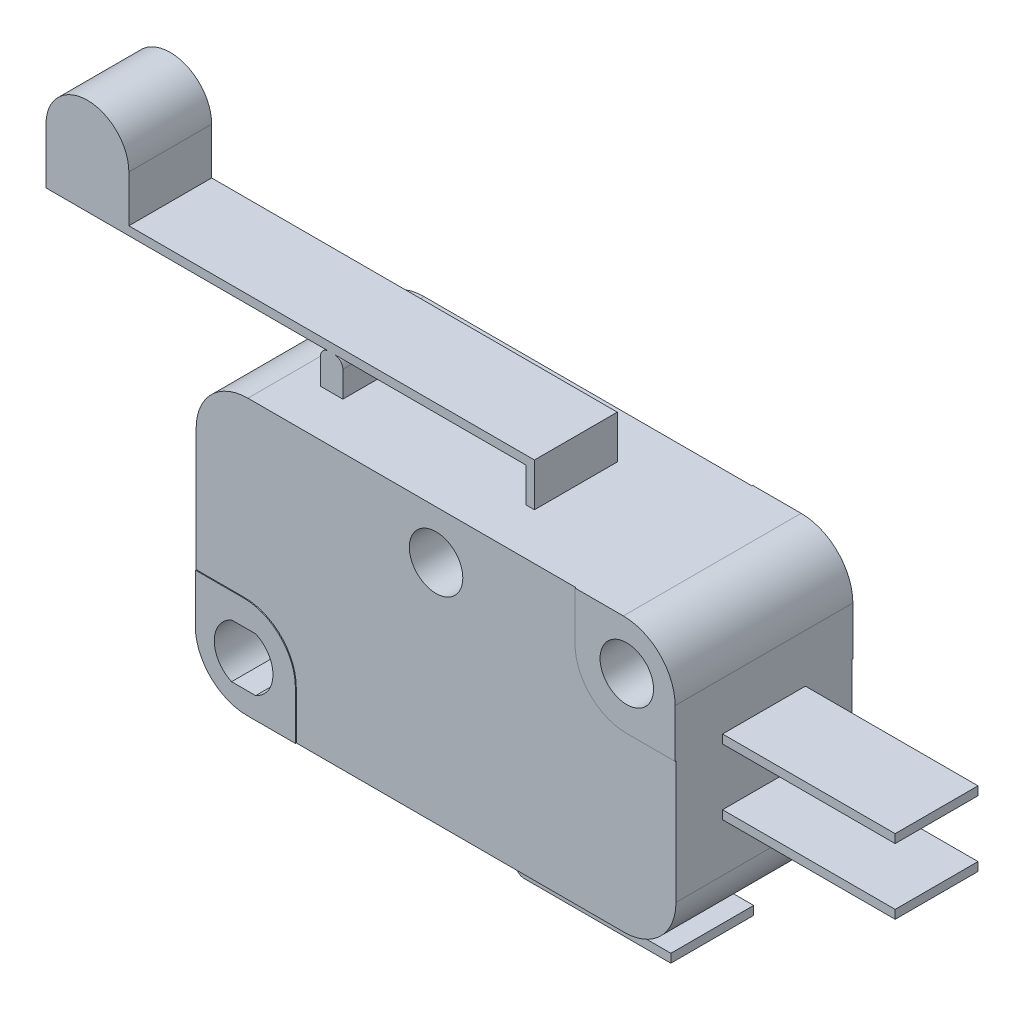
from build123d import *

# Parameters (mm, degrees)
BOSS_EXTRUDE1_DEPTH      = 5.1
BOSS_EXTRUDE1_DEPTH_BACK = 5.1
SKETCH1_R                = 1.55
BOSS_EXTRUDE2_DEPTH      = 5.15
BOSS_EXTRUDE2_DEPTH_BACK = 5.15
SKETCH1_3_R              = 1.55
BOSS_EXTRUDE3_DEPTH      = 2.4
BOSS_EXTRUDE3_DEPTH_BACK = 2.4
SKETCH1_4_W              = 10
SKETCH1_4_H              = 0.5


with BuildPart() as part:
    # Sketch1 → Boss-Extrude1 (new, two sides: drawn at the far end of the back side and taken through both)
    with BuildSketch(Plane.XY.offset(-BOSS_EXTRUDE1_DEPTH_BACK)):
        with BuildLine():
            Line((5.8, 2.8), (5.8, 0))
            Line((5.8, 0), (15.802181202, 0))
            Line((15.802181202, 0), (16.302181202, 0))
            Line((16.302181202, 0), (24.8, 0))
            ThreePointArc((24.8, 0), (26.921320344, 0.878679656), (27.8, 3))
            Line((27.8, 3), (27.8, 5.8))
            Line((27.8, 5.8), (27.8, 6.3))
            Line((27.8, 6.3), (27.8, 9.6))
            Line((27.8, 9.6), (27.8, 10.1))
            Line((27.8, 10.1), (25, 10.1))
            ThreePointArc((25, 10.1), (22.878679656, 10.978679656), (22, 13.1))
            Line((22, 13.1), (22, 15.9))
            Line((22, 15.9), (16.9, 15.9))
            Line((16.9, 15.9), (16.4, 15.9))
            Line((16.4, 15.9), (5.8, 15.9))
            Line((5.8, 15.9), (4.5, 15.9))
            Line((4.5, 15.9), (3, 15.9))
            ThreePointArc((3, 15.9), (0.878679656, 15.021320344), (0, 12.9))
            Line((0, 12.9), (0, 5.8))
            Line((0, 5.8), (2.8, 5.8))
            ThreePointArc((2.8, 5.8), (4.921320344, 4.921320344), (5.8, 2.8))
        make_face()
        with Locations((13.9, 13.1)):
            Circle(SKETCH1_R, mode=Mode.SUBTRACT)
    extrude(amount=BOSS_EXTRUDE1_DEPTH + BOSS_EXTRUDE1_DEPTH_BACK)

    # Sketch1<3> → Boss-Extrude2 (add, two sides: drawn at the far end of the back side and taken through both)
    # profile 1 of 2: a face of its own
    with BuildSketch(Plane.XY.offset(-BOSS_EXTRUDE2_DEPTH_BACK)):
        with BuildLine():
            ThreePointArc((0, 3), (0.878679656, 0.878679656), (3, 0))
            Line((3, 0), (5.8, 0))
            Line((5.8, 0), (5.8, 2.8))
            ThreePointArc((5.8, 2.8), (4.921320344, 4.921320344), (2.8, 5.8))
            Line((2.8, 5.8), (0, 5.8))
            Line((0, 5.8), (0, 3))
        make_face()
        with BuildLine():
            Line((3.498212002, 1.25), (2.101787998, 1.25))
            ThreePointArc((2.101787998, 1.25), (1.1, 2.8), (2.101787998, 4.35))
            Line((2.101787998, 4.35), (3.498212002, 4.35))
            ThreePointArc((3.498212002, 4.35), (4.5, 2.8), (3.498212002, 1.25))
        make_face(mode=Mode.SUBTRACT)
    # profile 2 of 2: a face of its own
    with BuildSketch(Plane.XY.offset(-BOSS_EXTRUDE2_DEPTH_BACK)):
        with BuildLine():
            Line((25, 10.1), (27.8, 10.1))
            Line((27.8, 10.1), (27.8, 12.9))
            ThreePointArc((27.8, 12.9), (26.921320344, 15.021320344), (24.8, 15.9))
            Line((24.8, 15.9), (22, 15.9))
            Line((22, 15.9), (22, 13.1))
            ThreePointArc((22, 13.1), (22.878679656, 10.978679656), (25, 10.1))
        make_face()
        with Locations((25, 13.1)):
            Circle(SKETCH1_3_R, mode=Mode.SUBTRACT)
    extrude(amount=BOSS_EXTRUDE2_DEPTH + BOSS_EXTRUDE2_DEPTH_BACK)

    # Sketch1<4> → Boss-Extrude3 (add, two sides: drawn at the far end of the back side and taken through both)
    with BuildSketch(Plane.XY.offset(-BOSS_EXTRUDE3_DEPTH_BACK)):
        with BuildLine():
            Line((16.302181202, 0), (15.802181202, 0))
            Line((15.802181202, 0), (15.802181202, -2.4))
            ThreePointArc((15.802181202, -2.4), (15.948627812, -2.753553391), (16.302181202, -2.9))
            Line((16.302181202, -2.9), (24.80383619, -2.9))
            Line((24.80383619, -2.9), (24.80383619, -2.4))
            Line((24.80383619, -2.4), (16.302181202, -2.4))
            Line((16.302181202, -2.4), (16.302181202, 0))
        make_face()
        with BuildLine():
            Line((4.5, 17.4), (4.5, 15.9))
            Line((4.5, 15.9), (5.8, 15.9))
            Line((5.8, 15.9), (5.8, 17.4))
            ThreePointArc((5.8, 17.4), (5.653553391, 17.753553391), (5.3, 17.9))
            Line((5.3, 17.9), (16.4, 17.9))
            Line((16.4, 17.9), (16.4, 15.9))
            Line((16.4, 15.9), (16.9, 15.9))
            Line((16.9, 15.9), (16.9, 18.4))
            Line((16.9, 18.4), (-6.6, 18.4))
            Line((-6.6, 18.4), (-6.6, 21.1))
            ThreePointArc((-6.6, 21.1), (-9, 23.5), (-11.4, 21.1))
            Line((-11.4, 21.1), (-11.4, 17.9))
            Line((-11.4, 17.9), (5, 17.9))
            ThreePointArc((5, 17.9), (4.646446609, 17.753553391), (4.5, 17.4))
        make_face()
        with Locations((32.8, 6.05)):
            Rectangle(SKETCH1_4_W, SKETCH1_4_H)
        with Locations((32.8, 9.85)):
            Rectangle(SKETCH1_4_W, SKETCH1_4_H)
    extrude(amount=BOSS_EXTRUDE3_DEPTH + BOSS_EXTRUDE3_DEPTH_BACK)


solid = part.part
